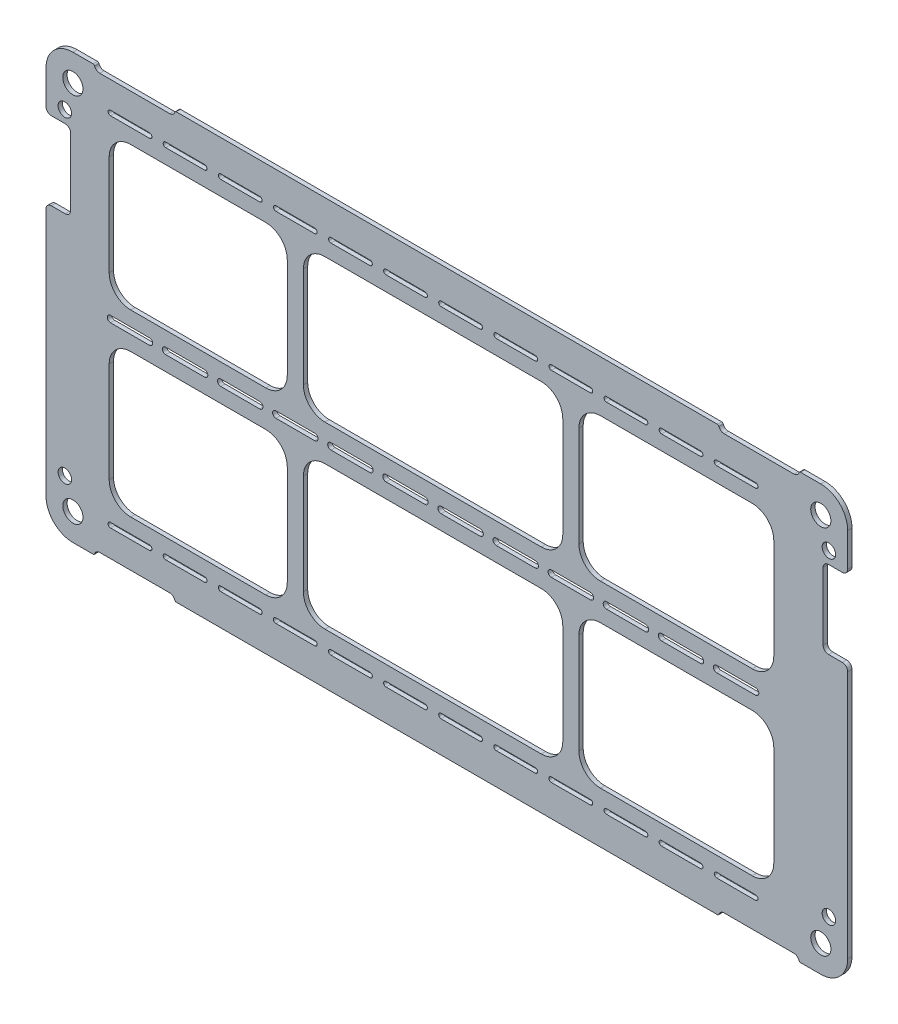
from build123d import *

# Parameters (mm, degrees)
SKETCH1_R           = 3.75
SKETCH1_R_2         = 2.5
BOSS_EXTRUDE1_DEPTH = 1.6


with BuildPart() as part:
    # Sketch1 → Boss-Extrude1 (new body)
    with BuildSketch(Plane.XY):
        with BuildLine():
            Line((-139.125, -79), (-131.598863375, -79))
            ThreePointArc((-131.598863375, -79), (-131.245854332, -78.885164524), (-131.027971827, -78.584615385))
            ThreePointArc((-131.027971827, -78.584615385), (-130.301696811, -77.58278492), (-129.125, -77.2))
            Line((-129.125, -77.2), (-103.125, -77.2))
            ThreePointArc((-103.125, -77.2), (-101.948303189, -77.58278492), (-101.222028173, -78.584615385))
            ThreePointArc((-101.222028173, -78.584615385), (-101.004145668, -78.885164524), (-100.651136625, -79))
            Line((-100.651136625, -79), (100.651136625, -79))
            ThreePointArc((100.651136625, -79), (101.004145668, -78.885164524), (101.222028173, -78.584615385))
            ThreePointArc((101.222028173, -78.584615385), (101.948303189, -77.58278492), (103.125, -77.2))
            Line((103.125, -77.2), (129.125, -77.2))
            ThreePointArc((129.125, -77.2), (130.301696811, -77.58278492), (131.027971827, -78.584615385))
            ThreePointArc((131.027971827, -78.584615385), (131.245854332, -78.885164524), (131.598863375, -79))
            Line((131.598863375, -79), (139.125, -79))
            ThreePointArc((139.125, -79), (146.196067812, -76.071067812), (149.125, -69))
            Line((149.125, -69), (149.125, 23.5))
            ThreePointArc((149.125, 23.5), (148.539213562, 24.914213562), (147.125, 25.5))
            Line((147.125, 25.5), (141.975, 25.5))
            ThreePointArc((141.975, 25.5), (140.560786438, 26.085786438), (139.975, 27.5))
            Line((139.975, 27.5), (139.975, 52.5))
            ThreePointArc((139.975, 52.5), (140.560786438, 53.914213562), (141.975, 54.5))
            Line((141.975, 54.5), (147.125, 54.5))
            ThreePointArc((147.125, 54.5), (148.539213562, 55.085786438), (149.125, 56.5))
            Line((149.125, 56.5), (149.125, 69))
            ThreePointArc((149.125, 69), (146.196067812, 76.071067812), (139.125, 79))
            Line((139.125, 79), (131.598863375, 79))
            ThreePointArc((131.598863375, 79), (131.245854332, 78.885164524), (131.027971827, 78.584615385))
            ThreePointArc((131.027971827, 78.584615385), (130.301696811, 77.58278492), (129.125, 77.2))
            Line((129.125, 77.2), (103.125, 77.2))
            ThreePointArc((103.125, 77.2), (101.948303189, 77.58278492), (101.222028173, 78.584615385))
            ThreePointArc((101.222028173, 78.584615385), (101.004145668, 78.885164524), (100.651136625, 79))
            Line((100.651136625, 79), (-100.651136625, 79))
            ThreePointArc((-100.651136625, 79), (-101.004145668, 78.885164524), (-101.222028173, 78.584615385))
            ThreePointArc((-101.222028173, 78.584615385), (-101.948303189, 77.58278492), (-103.125, 77.2))
            Line((-103.125, 77.2), (-129.125, 77.2))
            ThreePointArc((-129.125, 77.2), (-130.301696811, 77.58278492), (-131.027971827, 78.584615385))
            ThreePointArc((-131.027971827, 78.584615385), (-131.245854332, 78.885164524), (-131.598863375, 79))
            Line((-131.598863375, 79), (-139.125, 79))
            ThreePointArc((-139.125, 79), (-146.196067812, 76.071067812), (-149.125, 69))
            Line((-149.125, 69), (-149.125, 56.5))
            ThreePointArc((-149.125, 56.5), (-148.539213562, 55.085786438), (-147.125, 54.5))
            Line((-147.125, 54.5), (-141.975, 54.5))
            ThreePointArc((-141.975, 54.5), (-140.560786438, 53.914213562), (-139.975, 52.5))
            Line((-139.975, 52.5), (-139.975, 27.5))
            ThreePointArc((-139.975, 27.5), (-140.560786438, 26.085786438), (-141.975, 25.5))
            Line((-141.975, 25.5), (-147.125, 25.5))
            ThreePointArc((-147.125, 25.5), (-148.539213562, 24.914213562), (-149.125, 23.5))
            Line((-149.125, 23.5), (-149.125, -69))
            ThreePointArc((-149.125, -69), (-146.196067812, -76.071067812), (-139.125, -79))
        make_face()
        with Locations((-139.125, 69)):
            Circle(SKETCH1_R, mode=Mode.SUBTRACT)
        with Locations((-139.125, -69)):
            Circle(SKETCH1_R, mode=Mode.SUBTRACT)
        with Locations((139.125, -69)):
            Circle(SKETCH1_R, mode=Mode.SUBTRACT)
        with Locations((139.125, 69)):
            Circle(SKETCH1_R, mode=Mode.SUBTRACT)
        with Locations((-142.125, 59)):
            Circle(SKETCH1_R_2, mode=Mode.SUBTRACT)
        with Locations(Location((142.125, 59, 0), (0, 0, 180))):
            Circle(SKETCH1_R_2, mode=Mode.SUBTRACT)
        with Locations((142.125, -59)):
            Circle(SKETCH1_R_2, mode=Mode.SUBTRACT)
        with Locations(Location((-142.125, -59, 0), (0, 0, 180))):
            Circle(SKETCH1_R_2, mode=Mode.SUBTRACT)
        with BuildLine():
            Line((-117.625, 60), (-67.375, 60))
            ThreePointArc((-67.375, 60), (-61.718145751, 57.656854249), (-59.375, 52))
            Line((-59.375, 52), (-59.375, 14.7))
            ThreePointArc((-59.375, 14.7), (-61.718145751, 9.043145751), (-67.375, 6.7))
            Line((-67.375, 6.7), (-117.625, 6.7))
            ThreePointArc((-117.625, 6.7), (-123.281854249, 9.043145751), (-125.625, 14.7))
            Line((-125.625, 14.7), (-125.625, 52))
            ThreePointArc((-125.625, 52), (-123.281854249, 57.656854249), (-117.625, 60))
        make_face(mode=Mode.SUBTRACT)
        with BuildLine():
            Line((-45.375, 6.7), (35.125, 6.7))
            ThreePointArc((35.125, 6.7), (40.781854249, 9.043145751), (43.125, 14.7))
            Line((43.125, 14.7), (43.125, 52))
            ThreePointArc((43.125, 52), (40.781854249, 57.656854249), (35.125, 60))
            Line((35.125, 60), (-45.375, 60))
            ThreePointArc((-45.375, 60), (-51.031854249, 57.656854249), (-53.375, 52))
            Line((-53.375, 52), (-53.375, 14.7))
            ThreePointArc((-53.375, 14.7), (-51.031854249, 9.043145751), (-45.375, 6.7))
        make_face(mode=Mode.SUBTRACT)
        with BuildLine():
            Line((57.125, 60), (113.625, 60))
            ThreePointArc((113.625, 60), (119.281854249, 57.656854249), (121.625, 52))
            Line((121.625, 52), (121.625, 14.7))
            ThreePointArc((121.625, 14.7), (119.281854249, 9.043145751), (113.625, 6.7))
            Line((113.625, 6.7), (57.125, 6.7))
            ThreePointArc((57.125, 6.7), (51.468145751, 9.043145751), (49.125, 14.7))
            Line((49.125, 14.7), (49.125, 52))
            ThreePointArc((49.125, 52), (51.468145751, 57.656854249), (57.125, 60))
        make_face(mode=Mode.SUBTRACT)
        with BuildLine():
            Line((57.125, -6.7), (113.625, -6.7))
            ThreePointArc((113.625, -6.7), (119.281854249, -9.043145751), (121.625, -14.7))
            Line((121.625, -14.7), (121.625, -52))
            ThreePointArc((121.625, -52), (119.281854249, -57.656854249), (113.625, -60))
            Line((113.625, -60), (57.125, -60))
            ThreePointArc((57.125, -60), (51.468145751, -57.656854249), (49.125, -52))
            Line((49.125, -52), (49.125, -14.7))
            ThreePointArc((49.125, -14.7), (51.468145751, -9.043145751), (57.125, -6.7))
        make_face(mode=Mode.SUBTRACT)
        with BuildLine():
            Line((-45.375, -60), (35.125, -60))
            ThreePointArc((35.125, -60), (40.781854249, -57.656854249), (43.125, -52))
            Line((43.125, -52), (43.125, -14.7))
            ThreePointArc((43.125, -14.7), (40.781854249, -9.043145751), (35.125, -6.7))
            Line((35.125, -6.7), (-45.375, -6.7))
            ThreePointArc((-45.375, -6.7), (-51.031854249, -9.043145751), (-53.375, -14.7))
            Line((-53.375, -14.7), (-53.375, -52))
            ThreePointArc((-53.375, -52), (-51.031854249, -57.656854249), (-45.375, -60))
        make_face(mode=Mode.SUBTRACT)
        with BuildLine():
            Line((-117.625, -6.7), (-67.375, -6.7))
            ThreePointArc((-67.375, -6.7), (-61.718145751, -9.043145751), (-59.375, -14.7))
            Line((-59.375, -14.7), (-59.375, -52))
            ThreePointArc((-59.375, -52), (-61.718145751, -57.656854249), (-67.375, -60))
            Line((-67.375, -60), (-117.625, -60))
            ThreePointArc((-117.625, -60), (-123.281854249, -57.656854249), (-125.625, -52))
            Line((-125.625, -52), (-125.625, -14.7))
            ThreePointArc((-125.625, -14.7), (-123.281854249, -9.043145751), (-117.625, -6.7))
        make_face(mode=Mode.SUBTRACT)
        with BuildLine():
            Line((-125.125, 67.3), (-110.625, 67.3))
            ThreePointArc((-110.625, 67.3), (-109.725, 66.4), (-110.625, 65.5))
            Line((-110.625, 65.5), (-125.125, 65.5))
            ThreePointArc((-125.125, 65.5), (-126.025, 66.4), (-125.125, 67.3))
        make_face(mode=Mode.SUBTRACT)
        with BuildLine():
            Line((-125.125, 1.2), (-110.625, 1.2))
            ThreePointArc((-110.625, 1.2), (-109.425, 0), (-110.625, -1.2))
            Line((-110.625, -1.2), (-125.125, -1.2))
            ThreePointArc((-125.125, -1.2), (-126.325, 0), (-125.125, 1.2))
        make_face(mode=Mode.SUBTRACT)
        with BuildLine():
            Line((-125.125, -67.3), (-110.625, -67.3))
            ThreePointArc((-110.625, -67.3), (-109.725, -66.4), (-110.625, -65.5))
            Line((-110.625, -65.5), (-125.125, -65.5))
            ThreePointArc((-125.125, -65.5), (-126.025, -66.4), (-125.125, -67.3))
        make_face(mode=Mode.SUBTRACT)
        with BuildLine():
            Line((-104.625, 67.3), (-90.125, 67.3))
            ThreePointArc((-90.125, 67.3), (-89.225, 66.4), (-90.125, 65.5))
            Line((-90.125, 65.5), (-104.625, 65.5))
            ThreePointArc((-104.625, 65.5), (-105.525, 66.4), (-104.625, 67.3))
        make_face(mode=Mode.SUBTRACT)
        with BuildLine():
            Line((-104.625, 1.2), (-90.125, 1.2))
            ThreePointArc((-90.125, 1.2), (-88.925, 0), (-90.125, -1.2))
            Line((-90.125, -1.2), (-104.625, -1.2))
            ThreePointArc((-104.625, -1.2), (-105.825, 0), (-104.625, 1.2))
        make_face(mode=Mode.SUBTRACT)
        with BuildLine():
            Line((-104.625, -67.3), (-90.125, -67.3))
            ThreePointArc((-90.125, -67.3), (-89.225, -66.4), (-90.125, -65.5))
            Line((-90.125, -65.5), (-104.625, -65.5))
            ThreePointArc((-104.625, -65.5), (-105.525, -66.4), (-104.625, -67.3))
        make_face(mode=Mode.SUBTRACT)
        with BuildLine():
            Line((-84.125, 67.3), (-69.625, 67.3))
            ThreePointArc((-69.625, 67.3), (-68.725, 66.4), (-69.625, 65.5))
            Line((-69.625, 65.5), (-84.125, 65.5))
            ThreePointArc((-84.125, 65.5), (-85.025, 66.4), (-84.125, 67.3))
        make_face(mode=Mode.SUBTRACT)
        with BuildLine():
            Line((-84.125, 1.2), (-69.625, 1.2))
            ThreePointArc((-69.625, 1.2), (-68.425, 0), (-69.625, -1.2))
            Line((-69.625, -1.2), (-84.125, -1.2))
            ThreePointArc((-84.125, -1.2), (-85.325, 0), (-84.125, 1.2))
        make_face(mode=Mode.SUBTRACT)
        with BuildLine():
            Line((-84.125, -67.3), (-69.625, -67.3))
            ThreePointArc((-69.625, -67.3), (-68.725, -66.4), (-69.625, -65.5))
            Line((-69.625, -65.5), (-84.125, -65.5))
            ThreePointArc((-84.125, -65.5), (-85.025, -66.4), (-84.125, -67.3))
        make_face(mode=Mode.SUBTRACT)
        with BuildLine():
            Line((-63.625, 67.3), (-49.125, 67.3))
            ThreePointArc((-49.125, 67.3), (-48.225, 66.4), (-49.125, 65.5))
            Line((-49.125, 65.5), (-63.625, 65.5))
            ThreePointArc((-63.625, 65.5), (-64.525, 66.4), (-63.625, 67.3))
        make_face(mode=Mode.SUBTRACT)
        with BuildLine():
            Line((-63.625, 1.2), (-49.125, 1.2))
            ThreePointArc((-49.125, 1.2), (-47.925, 0), (-49.125, -1.2))
            Line((-49.125, -1.2), (-63.625, -1.2))
            ThreePointArc((-63.625, -1.2), (-64.825, 0), (-63.625, 1.2))
        make_face(mode=Mode.SUBTRACT)
        with BuildLine():
            Line((-63.625, -67.3), (-49.125, -67.3))
            ThreePointArc((-49.125, -67.3), (-48.225, -66.4), (-49.125, -65.5))
            Line((-49.125, -65.5), (-63.625, -65.5))
            ThreePointArc((-63.625, -65.5), (-64.525, -66.4), (-63.625, -67.3))
        make_face(mode=Mode.SUBTRACT)
        with BuildLine():
            Line((-43.125, 67.3), (-28.625, 67.3))
            ThreePointArc((-28.625, 67.3), (-27.725, 66.4), (-28.625, 65.5))
            Line((-28.625, 65.5), (-43.125, 65.5))
            ThreePointArc((-43.125, 65.5), (-44.025, 66.4), (-43.125, 67.3))
        make_face(mode=Mode.SUBTRACT)
        with BuildLine():
            Line((-43.125, 1.2), (-28.625, 1.2))
            ThreePointArc((-28.625, 1.2), (-27.425, 0), (-28.625, -1.2))
            Line((-28.625, -1.2), (-43.125, -1.2))
            ThreePointArc((-43.125, -1.2), (-44.325, 0), (-43.125, 1.2))
        make_face(mode=Mode.SUBTRACT)
        with BuildLine():
            Line((-43.125, -67.3), (-28.625, -67.3))
            ThreePointArc((-28.625, -67.3), (-27.725, -66.4), (-28.625, -65.5))
            Line((-28.625, -65.5), (-43.125, -65.5))
            ThreePointArc((-43.125, -65.5), (-44.025, -66.4), (-43.125, -67.3))
        make_face(mode=Mode.SUBTRACT)
        with BuildLine():
            Line((-22.625, 67.3), (-8.125, 67.3))
            ThreePointArc((-8.125, 67.3), (-7.225, 66.4), (-8.125, 65.5))
            Line((-8.125, 65.5), (-22.625, 65.5))
            ThreePointArc((-22.625, 65.5), (-23.525, 66.4), (-22.625, 67.3))
        make_face(mode=Mode.SUBTRACT)
        with BuildLine():
            Line((-22.625, 1.2), (-8.125, 1.2))
            ThreePointArc((-8.125, 1.2), (-6.925, 0), (-8.125, -1.2))
            Line((-8.125, -1.2), (-22.625, -1.2))
            ThreePointArc((-22.625, -1.2), (-23.825, 0), (-22.625, 1.2))
        make_face(mode=Mode.SUBTRACT)
        with BuildLine():
            Line((-22.625, -67.3), (-8.125, -67.3))
            ThreePointArc((-8.125, -67.3), (-7.225, -66.4), (-8.125, -65.5))
            Line((-8.125, -65.5), (-22.625, -65.5))
            ThreePointArc((-22.625, -65.5), (-23.525, -66.4), (-22.625, -67.3))
        make_face(mode=Mode.SUBTRACT)
        with BuildLine():
            Line((-2.125, 67.3), (12.375, 67.3))
            ThreePointArc((12.375, 67.3), (13.275, 66.4), (12.375, 65.5))
            Line((12.375, 65.5), (-2.125, 65.5))
            ThreePointArc((-2.125, 65.5), (-3.025, 66.4), (-2.125, 67.3))
        make_face(mode=Mode.SUBTRACT)
        with BuildLine():
            Line((-2.125, 1.2), (12.375, 1.2))
            ThreePointArc((12.375, 1.2), (13.575, 0), (12.375, -1.2))
            Line((12.375, -1.2), (-2.125, -1.2))
            ThreePointArc((-2.125, -1.2), (-3.325, 0), (-2.125, 1.2))
        make_face(mode=Mode.SUBTRACT)
        with BuildLine():
            Line((-2.125, -67.3), (12.375, -67.3))
            ThreePointArc((12.375, -67.3), (13.275, -66.4), (12.375, -65.5))
            Line((12.375, -65.5), (-2.125, -65.5))
            ThreePointArc((-2.125, -65.5), (-3.025, -66.4), (-2.125, -67.3))
        make_face(mode=Mode.SUBTRACT)
        with BuildLine():
            Line((18.375, 67.3), (32.875, 67.3))
            ThreePointArc((32.875, 67.3), (33.775, 66.4), (32.875, 65.5))
            Line((32.875, 65.5), (18.375, 65.5))
            ThreePointArc((18.375, 65.5), (17.475, 66.4), (18.375, 67.3))
        make_face(mode=Mode.SUBTRACT)
        with BuildLine():
            Line((18.375, 1.2), (32.875, 1.2))
            ThreePointArc((32.875, 1.2), (34.075, 0), (32.875, -1.2))
            Line((32.875, -1.2), (18.375, -1.2))
            ThreePointArc((18.375, -1.2), (17.175, 0), (18.375, 1.2))
        make_face(mode=Mode.SUBTRACT)
        with BuildLine():
            Line((18.375, -67.3), (32.875, -67.3))
            ThreePointArc((32.875, -67.3), (33.775, -66.4), (32.875, -65.5))
            Line((32.875, -65.5), (18.375, -65.5))
            ThreePointArc((18.375, -65.5), (17.475, -66.4), (18.375, -67.3))
        make_face(mode=Mode.SUBTRACT)
        with BuildLine():
            Line((38.875, 67.3), (53.375, 67.3))
            ThreePointArc((53.375, 67.3), (54.275, 66.4), (53.375, 65.5))
            Line((53.375, 65.5), (38.875, 65.5))
            ThreePointArc((38.875, 65.5), (37.975, 66.4), (38.875, 67.3))
        make_face(mode=Mode.SUBTRACT)
        with BuildLine():
            Line((38.875, 1.2), (53.375, 1.2))
            ThreePointArc((53.375, 1.2), (54.575, 0), (53.375, -1.2))
            Line((53.375, -1.2), (38.875, -1.2))
            ThreePointArc((38.875, -1.2), (37.675, 0), (38.875, 1.2))
        make_face(mode=Mode.SUBTRACT)
        with BuildLine():
            Line((38.875, -67.3), (53.375, -67.3))
            ThreePointArc((53.375, -67.3), (54.275, -66.4), (53.375, -65.5))
            Line((53.375, -65.5), (38.875, -65.5))
            ThreePointArc((38.875, -65.5), (37.975, -66.4), (38.875, -67.3))
        make_face(mode=Mode.SUBTRACT)
        with BuildLine():
            Line((59.375, 67.3), (73.875, 67.3))
            ThreePointArc((73.875, 67.3), (74.775, 66.4), (73.875, 65.5))
            Line((73.875, 65.5), (59.375, 65.5))
            ThreePointArc((59.375, 65.5), (58.475, 66.4), (59.375, 67.3))
        make_face(mode=Mode.SUBTRACT)
        with BuildLine():
            Line((59.375, 1.2), (73.875, 1.2))
            ThreePointArc((73.875, 1.2), (75.075, 0), (73.875, -1.2))
            Line((73.875, -1.2), (59.375, -1.2))
            ThreePointArc((59.375, -1.2), (58.175, 0), (59.375, 1.2))
        make_face(mode=Mode.SUBTRACT)
        with BuildLine():
            Line((59.375, -67.3), (73.875, -67.3))
            ThreePointArc((73.875, -67.3), (74.775, -66.4), (73.875, -65.5))
            Line((73.875, -65.5), (59.375, -65.5))
            ThreePointArc((59.375, -65.5), (58.475, -66.4), (59.375, -67.3))
        make_face(mode=Mode.SUBTRACT)
        with BuildLine():
            Line((79.875, 67.3), (94.375, 67.3))
            ThreePointArc((94.375, 67.3), (95.275, 66.4), (94.375, 65.5))
            Line((94.375, 65.5), (79.875, 65.5))
            ThreePointArc((79.875, 65.5), (78.975, 66.4), (79.875, 67.3))
        make_face(mode=Mode.SUBTRACT)
        with BuildLine():
            Line((79.875, 1.2), (94.375, 1.2))
            ThreePointArc((94.375, 1.2), (95.575, 0), (94.375, -1.2))
            Line((94.375, -1.2), (79.875, -1.2))
            ThreePointArc((79.875, -1.2), (78.675, 0), (79.875, 1.2))
        make_face(mode=Mode.SUBTRACT)
        with BuildLine():
            Line((79.875, -67.3), (94.375, -67.3))
            ThreePointArc((94.375, -67.3), (95.275, -66.4), (94.375, -65.5))
            Line((94.375, -65.5), (79.875, -65.5))
            ThreePointArc((79.875, -65.5), (78.975, -66.4), (79.875, -67.3))
        make_face(mode=Mode.SUBTRACT)
        with BuildLine():
            Line((100.375, 67.3), (114.875, 67.3))
            ThreePointArc((114.875, 67.3), (115.775, 66.4), (114.875, 65.5))
            Line((114.875, 65.5), (100.375, 65.5))
            ThreePointArc((100.375, 65.5), (99.475, 66.4), (100.375, 67.3))
        make_face(mode=Mode.SUBTRACT)
        with BuildLine():
            Line((100.375, 1.2), (114.875, 1.2))
            ThreePointArc((114.875, 1.2), (116.075, 0), (114.875, -1.2))
            Line((114.875, -1.2), (100.375, -1.2))
            ThreePointArc((100.375, -1.2), (99.175, 0), (100.375, 1.2))
        make_face(mode=Mode.SUBTRACT)
        with BuildLine():
            Line((100.375, -67.3), (114.875, -67.3))
            ThreePointArc((114.875, -67.3), (115.775, -66.4), (114.875, -65.5))
            Line((114.875, -65.5), (100.375, -65.5))
            ThreePointArc((100.375, -65.5), (99.475, -66.4), (100.375, -67.3))
        make_face(mode=Mode.SUBTRACT)
    extrude(amount=BOSS_EXTRUDE1_DEPTH)


solid = part.part
